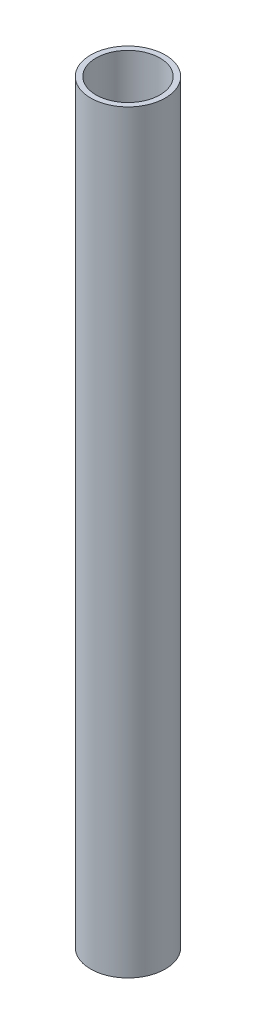
from build123d import *

# Parameters (mm, degrees)
CROQUIS1_R              = 14
CROQUIS1_R_2            = 12
SALIENTE_EXTRUIR1_DEPTH = 283


with BuildPart() as part:
    # Croquis1 → Saliente-Extruir1 (new body)
    with BuildSketch(Plane(origin=(0, 0, 0), x_dir=(1, 0, 0), z_dir=(0, 1, 0))):
        with Locations(Location((0, 0, 0), (0, 0, 270))):
            Circle(CROQUIS1_R)
        with Locations(Location((0, 0, 0), (0, 0, 270))):
            Circle(CROQUIS1_R_2, mode=Mode.SUBTRACT)
    extrude(amount=SALIENTE_EXTRUIR1_DEPTH)


solid = part.part
